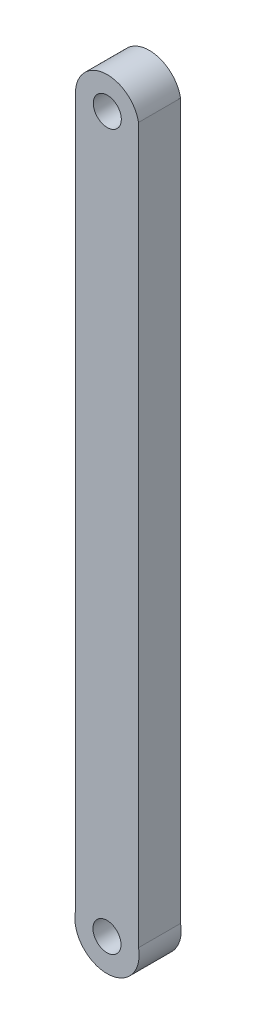
from build123d import *

# Parameters (mm, degrees)
SKETCH_1_R      = 1
EXTRUDE_1_DEPTH = 3


with BuildPart() as part:
    # 草图1 → 凸台-拉伸1 (new body)
    with BuildSketch(Plane.XY):
        with BuildLine():
            Line((-2.4, 50.563893142), (-2.4, 0.019680454))
            ThreePointArc((-2.4, 0.019680454), (-0.161981935, -2.729868209), (2.1, 0))
            Line((2.1, 0), (2.1, 50.995975371))
            ThreePointArc((2.1, 50.995975371), (-0.346290832, 52.824241293), (-2.4, 50.563893142))
        make_face()
        with Locations((-0.151950298, -0.436101809)):
            Circle(SKETCH_1_R, mode=Mode.SUBTRACT)
        with Locations((-0.129256105, 50.563893142)):
            Circle(SKETCH_1_R, mode=Mode.SUBTRACT)
    extrude(amount=EXTRUDE_1_DEPTH)


solid = part.part
